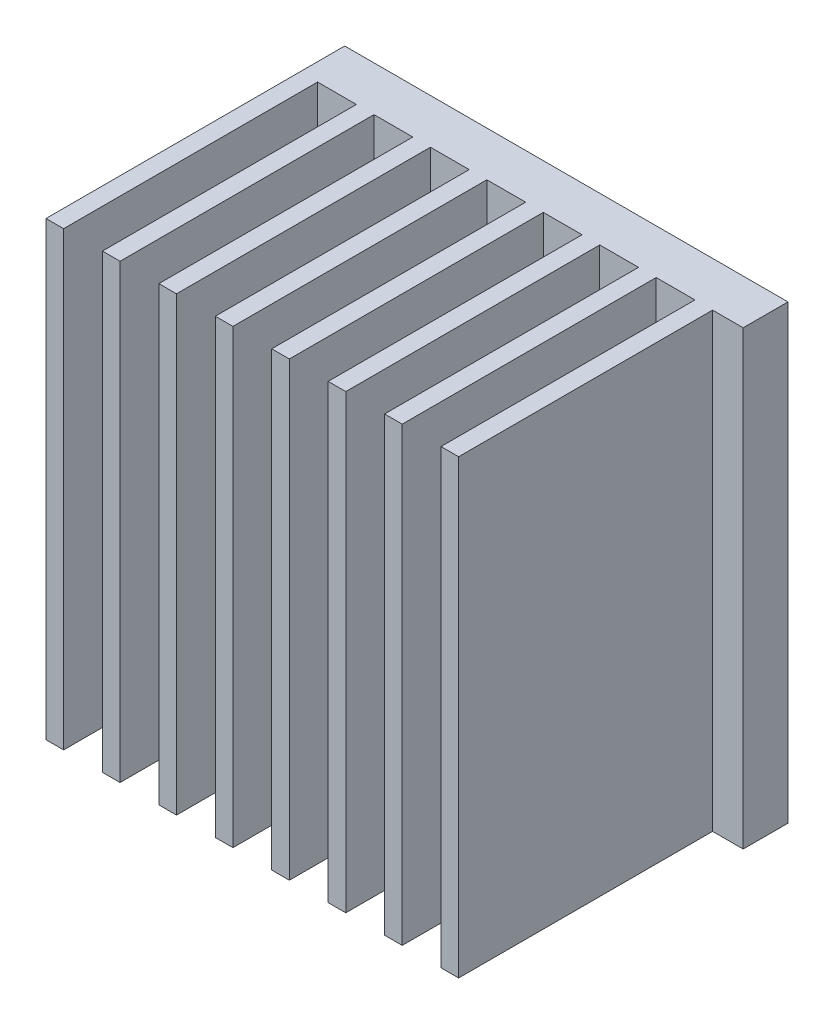
from build123d import *

# Parameters (mm, degrees)
SKETCH1_W           = 31.42
SKETCH1_H           = 32
BOSS_EXTRUDE1_DEPTH = 3.175
SKETCH2_W           = 1.25
SKETCH2_H           = 32
BOSS_EXTRUDE2_DEPTH = 18
LPATTERN1_COUNT     = 8
LPATTERN1_PITCH     = 4


with BuildPart() as part:
    # Sketch1 → Boss-Extrude1 (new body)
    with BuildSketch(Plane.XY):
        Rectangle(SKETCH1_W, SKETCH1_H)
    extrude(amount=BOSS_EXTRUDE1_DEPTH)

    # Sketch2 → Boss-Extrude2 (add)
    with BuildSketch(Plane.XY.offset(3.175)):
        with Locations((-15.085, 0)):
            Rectangle(SKETCH2_W, SKETCH2_H)
    boss_extrude2 = extrude(amount=BOSS_EXTRUDE2_DEPTH)

    # LPattern1: Boss-Extrude2 ×8
    with Locations(*[(i * LPATTERN1_PITCH, 0, 0) for i in range(1, LPATTERN1_COUNT)]):
        add(boss_extrude2)


solid = part.part
